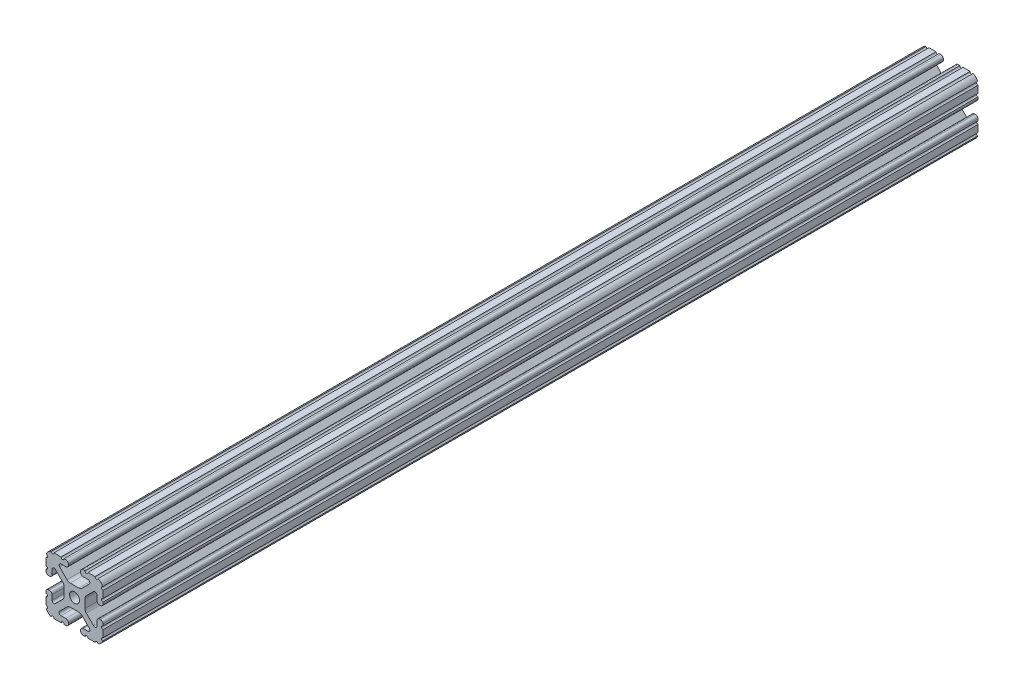
from build123d import *

# Parameters (mm, degrees)
BOSS_EXTRUDE1_DEPTH     = 292.5
CUT_EXTRUDE1_DEPTH      = 294.738072098
CUT_EXTRUDE1_DEPTH_BACK = 294.738072098
SKETCH5_R               = 1.016


with BuildPart() as part:
    # Sketch4 → Boss-Extrude1 (new, symmetric)
    with BuildSketch(Plane.XY):
        with BuildLine():
            Line((5.7912, -19.05), (14.3002, -19.05))
            ThreePointArc((14.3002, -19.05), (17.658815789, -17.658815789), (19.05, -14.3002))
            Line((19.05, -14.3002), (19.05, -5.7912))
            ThreePointArc((19.05, -5.7912), (18.544114832, -4.569885168), (17.3228, -4.064))
            Line((17.3228, -4.064), (16.7132, -4.064))
            ThreePointArc((16.7132, -4.064), (15.491885168, -4.569885168), (14.986, -5.7912))
            Line((14.986, -5.7912), (14.986, -8.996305235))
            ThreePointArc((14.986, -8.996305235), (14.189232738, -10.188751711), (12.782646215, -9.908964256))
            Line((12.782646215, -9.908964256), (7.888897763, -5.015215804))
            ThreePointArc((7.888897763, -5.015215804), (7.219915375, -4.014012907), (6.985, -2.833013566))
            Line((6.985, -2.833013566), (6.985, 0))
            Line((6.985, 0), (3.3274, 0))
            ThreePointArc((3.3274, 0), (2.352827104, -2.352827104), (0, -3.3274))
            Line((0, -3.3274), (0, -6.985))
            Line((0, -6.985), (2.833013566, -6.985))
            ThreePointArc((2.833013566, -6.985), (4.014012907, -7.219915375), (5.015215804, -7.888897763))
            Line((5.015215804, -7.888897763), (9.908964256, -12.782646215))
            ThreePointArc((9.908964256, -12.782646215), (10.188751711, -14.189232738), (8.996305235, -14.986))
            Line((8.996305235, -14.986), (5.7912, -14.986))
            ThreePointArc((5.7912, -14.986), (4.569885168, -15.491885168), (4.064, -16.7132))
            Line((4.064, -16.7132), (4.064, -17.3228))
            ThreePointArc((4.064, -17.3228), (4.569885168, -18.544114832), (5.7912, -19.05))
        make_face()
    extrude(amount=BOSS_EXTRUDE1_DEPTH, both=True)

    # Sketch5 → Cut-Extrude1 (cut, two sides: drawn at the far end of the back side and taken through both)
    with BuildSketch(Plane.XY.offset(-CUT_EXTRUDE1_DEPTH_BACK)):
        with Locations((14.739477062, -19.05)):
            Circle(SKETCH5_R)
        with Locations((7.980305235, -19.05)):
            Circle(SKETCH5_R)
        with Locations((19.05, -14.739477062)):
            Circle(SKETCH5_R)
        with Locations((19.05, -7.980305235)):
            Circle(SKETCH5_R)
    extrude(amount=CUT_EXTRUDE1_DEPTH + CUT_EXTRUDE1_DEPTH_BACK, mode=Mode.SUBTRACT)

    # Mirror1: part across plane


with BuildPart() as part_1:
    add(part.part)
    add(part.part.mirror(Plane(origin=(0, 0, 0), x_dir=(0, 0, 1), z_dir=(1, 0, 0))))

    # Mirror2: part across plane


with BuildPart() as part_2:
    add(part_1.part)
    add(part_1.part.mirror(Plane.ZX))


solid = part_2.part
